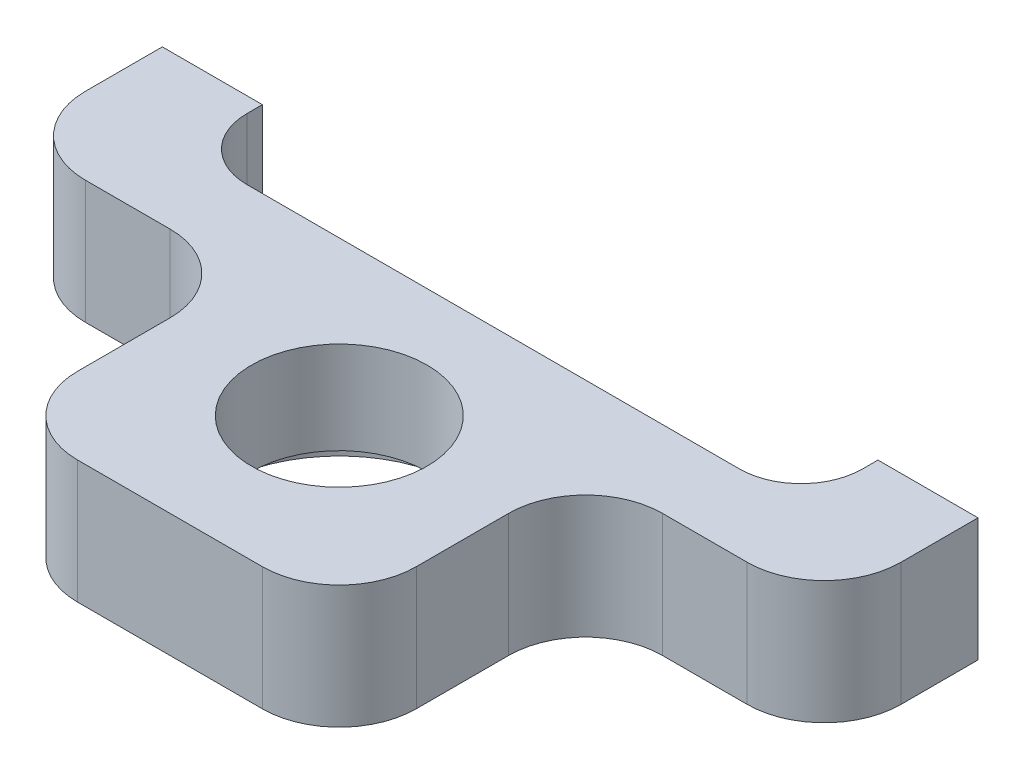
from build123d import *

# Parameters (mm, degrees)
SKETCH1_W                                = 53
SKETCH1_H                                = 26
BOSS_EXTRUDE1_DEPTH                      = 8
SKETCH2_W                                = 15.5
SKETCH2_H                                = 16
CUT_EXTRUDE1_DEPTH                       = 38.976966704
SKETCH3_W                                = 15.5
SKETCH3_H                                = 16
CUT_EXTRUDE2_DEPTH                       = 38.976966704
SKETCH4_W                                = 40.000000023
SKETCH4_H                                = 5
CUT_EXTRUDE3_DEPTH                       = 38.976966704
CBORE_FOR_M10_HEX_HEAD_BOLT1_D           = 11.4
CBORE_FOR_M10_HEX_HEAD_BOLT1_CBORE_D     = 16.2
CBORE_FOR_M10_HEX_HEAD_BOLT1_CBORE_DEPTH = 2
M4X0_7_TAPPED_HOLE1_D                    = 3.3
M4X0_7_TAPPED_HOLE1_DEPTH                = 6
M4X0_7_TAPPED_HOLE1_TIP                  = 0.991420021
FILLET1_R                                = 4
FILLET2_R                                = 5


with BuildPart() as part:
    # Sketch1 → Boss-Extrude1 (new body)
    with BuildSketch(Plane.XZ):
        with Locations((0, 13)):
            Rectangle(SKETCH1_W, SKETCH1_H)
    extrude(amount=-BOSS_EXTRUDE1_DEPTH)

    # Sketch2 → Cut-Extrude1 (cut, through all)
    with BuildSketch(Plane(origin=(0, 8, 0), x_dir=(-1, 0, 0), z_dir=(0, 1, 0))):
        with Locations((-18.75, 18)):
            Rectangle(SKETCH2_W, SKETCH2_H)
    extrude(amount=-CUT_EXTRUDE1_DEPTH, mode=Mode.SUBTRACT)

    # Sketch3 → Cut-Extrude2 (cut, through all)
    with BuildSketch(Plane(origin=(0, 8, 0), x_dir=(-1, 0, 0), z_dir=(0, 1, 0))):
        with Locations((18.75, 18)):
            Rectangle(SKETCH3_W, SKETCH3_H)
    extrude(amount=-CUT_EXTRUDE2_DEPTH, mode=Mode.SUBTRACT)

    # Sketch4 → Cut-Extrude3 (cut, through all)
    with BuildSketch(Plane(origin=(0, 8, 0), x_dir=(-1, 0, 0), z_dir=(0, 1, 0))):
        with Locations((1.2e-08, 2.5)):
            Rectangle(SKETCH4_W, SKETCH4_H)
    extrude(amount=-CUT_EXTRUDE3_DEPTH, mode=Mode.SUBTRACT)

    # CBORE for M10 Hex Head Bolt1 (through all)
    with Locations(Plane(origin=(0, 0, 0), x_dir=(-1, 0, 0), z_dir=(0, -1, 0))):
        with Locations((0, -15)):
            CounterBoreHole(CBORE_FOR_M10_HEX_HEAD_BOLT1_D / 2, CBORE_FOR_M10_HEX_HEAD_BOLT1_CBORE_D / 2, CBORE_FOR_M10_HEX_HEAD_BOLT1_CBORE_DEPTH)

    # M4x0.7 Tapped Hole1
    with Locations(Plane(origin=(0, 0, 0), x_dir=(-1, 0, 0), z_dir=(0, 0, -1))):
        with Locations((-23.25, 4), (23.25, 4)):
            Hole(M4X0_7_TAPPED_HOLE1_D / 2, depth=M4X0_7_TAPPED_HOLE1_DEPTH)
            with Locations((0, 0, -(M4X0_7_TAPPED_HOLE1_DEPTH + M4X0_7_TAPPED_HOLE1_TIP / 2))):  # 118° drill point
                Cone(0, M4X0_7_TAPPED_HOLE1_D / 2, M4X0_7_TAPPED_HOLE1_TIP, mode=Mode.SUBTRACT)

    # Fillet1
    fillet1_edges = [part.edges().sort_by_distance(p)[0] for p in [
        (20, 4, 5),
        (-20.000000023, 4, 5),
    ]]
    fillet(fillet1_edges, radius=FILLET1_R)

    # Fillet2
    fillet2_edges = [part.edges().sort_by_distance(p)[0] for p in [
        (11, 4, 10),
        (26.5, 4, 10),
        (11, 4, 26),
        (-11, 4, 26),
        (-26.5, 4, 10),
        (-11, 4, 10),
    ]]
    fillet(fillet2_edges, radius=FILLET2_R)


solid = part.part
